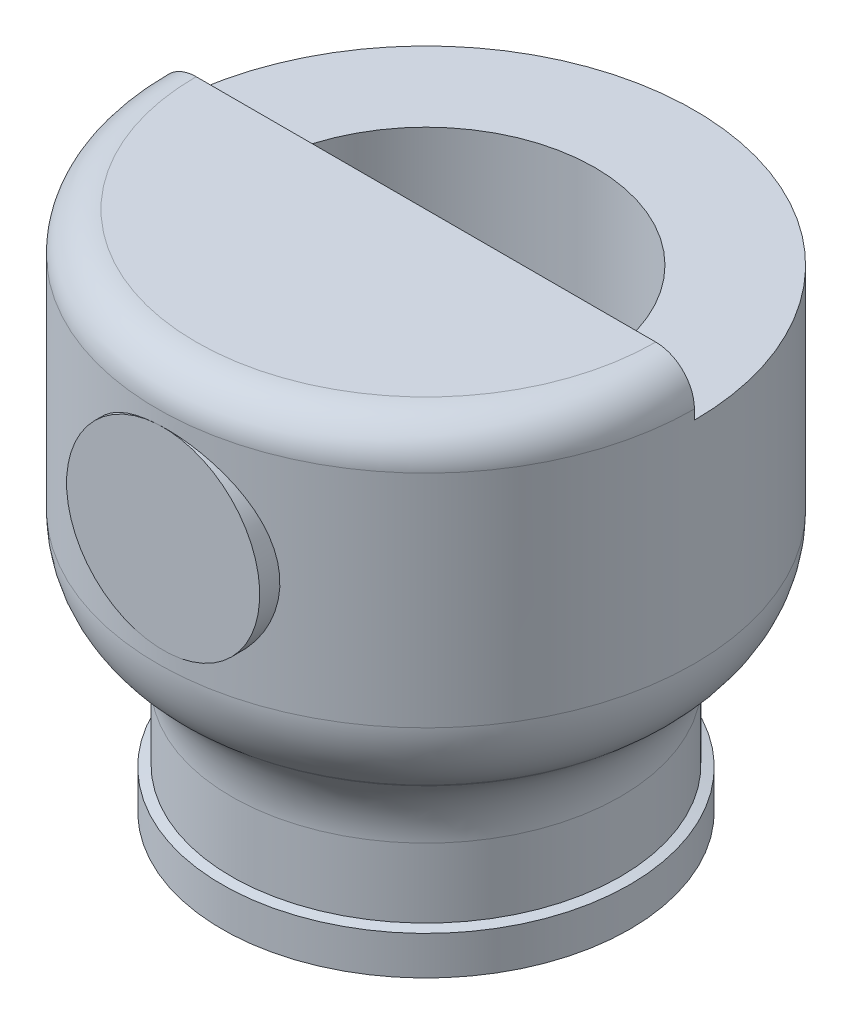
from build123d import *
from build123d.topology import SkipClean

# Parameters (mm, degrees)
SKETCH10_R              = 10
BOSS_EXTRUDE1_DEPTH     = 5
CUT_EXTRUDE3_DEPTH      = 45
CUT_EXTRUDE3_DEPTH_BACK = 20
CUT_EXTRUDE5_DEPTH      = 5


with BuildPart() as part:
    # Sketch1 → Revolve1 (revolve)
    with BuildSketch(Plane.XY):
        with BuildLine():
            Line((20.9, 0), (23.871591838, 0))
            Line((23.871591838, 0), (23.871591838, 4))
            Line((23.871591838, 4), (22.9, 4.236662843))
            Line((22.9, 4.236662843), (22.9, 11.404308102))
            ThreePointArc((22.9, 11.404308102), (23.83692213, 15.63049072), (26.472123903, 19.064752533))
            Line((26.472123903, 19.064752533), (26.988320528, 19.497892931))
            ThreePointArc((26.988320528, 19.497892931), (29.623522302, 22.932154745), (30.560444431, 27.158337362))
            Line((30.560444431, 27.158337362), (30.560444431, 50))
            ThreePointArc((30.560444431, 50), (29.388871556, 52.828427125), (26.560444431, 54))
            Line((26.560444431, 54), (2.764914955, 54))
            Line((2.764914955, 54), (2.764914955, 15))
            Line((2.764914955, 15), (19.9, 15))
            ThreePointArc((19.9, 15), (20.607106781, 14.707106781), (20.9, 14))
            Line((20.9, 14), (20.9, 0))
        make_face()
    revolve(axis=Axis((2.764914955, 7.821821657, 0), (0, 1, 0)))

    # Sketch10 → Boss-Extrude1 (add)
    with SkipClean():  # the faces are left unmerged after this step: merging them gives an invalid solid
        with BuildSketch(Plane.XY.offset(27.795529476)):
            with Locations((3.346345887, 38.658337362)):
                Circle(SKETCH10_R)
        extrude(amount=-BOSS_EXTRUDE1_DEPTH)

    # Sketch11 → Cut-Extrude3 (cut, two sides: drawn at the far end of the back side and taken through both)
    with SkipClean():  # the faces are left unmerged after this step: merging them gives an invalid solid
        with BuildSketch(Plane(origin=(0, 17, 0), x_dir=(1, 0, 0), z_dir=(0, 1, 0)).offset(-CUT_EXTRUDE3_DEPTH_BACK)):
            with BuildLine():
                Line((-14.735085045, 0), (20.264914955, 0))
                ThreePointArc((20.264914955, 0), (2.764914955, 17.5), (-14.735085045, 0))
            make_face()
        extrude(amount=CUT_EXTRUDE3_DEPTH + CUT_EXTRUDE3_DEPTH_BACK, mode=Mode.SUBTRACT)

    # Sketch9 → Cut-Extrude5 (cut)
    with SkipClean():  # the faces are left unmerged after this step: merging them gives an invalid solid
        with BuildSketch(Plane(origin=(0, 54, 0), x_dir=(1, 0, 0), z_dir=(0, 1, 0))):
            with BuildLine():
                Line((-25.235085045, 0), (30.764914955, 0))
                ThreePointArc((30.764914955, 0), (2.764914955, 28), (-25.235085045, 0))
            make_face()
        extrude(amount=-CUT_EXTRUDE5_DEPTH, mode=Mode.SUBTRACT)


solid = part.part
